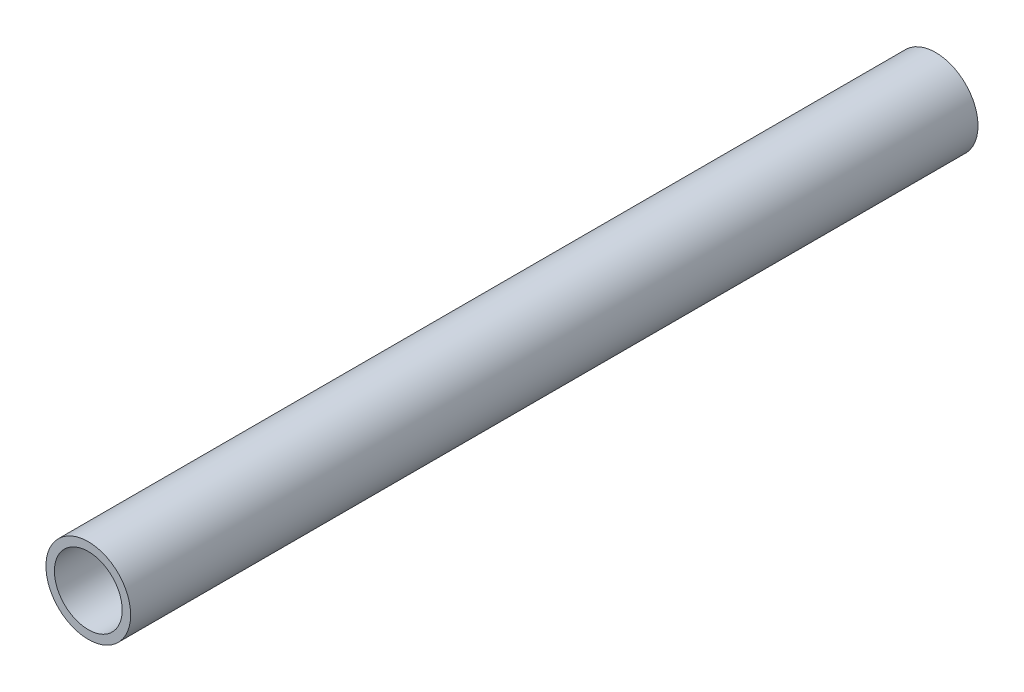
from build123d import *

# Parameters (mm, degrees)
SKETCH1_R           = 25
SKETCH1_R_2         = 20
BOSS_EXTRUDE1_DEPTH = 500


with BuildPart() as part:
    # Sketch1 → Boss-Extrude1 (new body)
    with BuildSketch(Plane.XY):
        Circle(SKETCH1_R)
        Circle(SKETCH1_R_2, mode=Mode.SUBTRACT)
    extrude(amount=BOSS_EXTRUDE1_DEPTH)


solid = part.part
